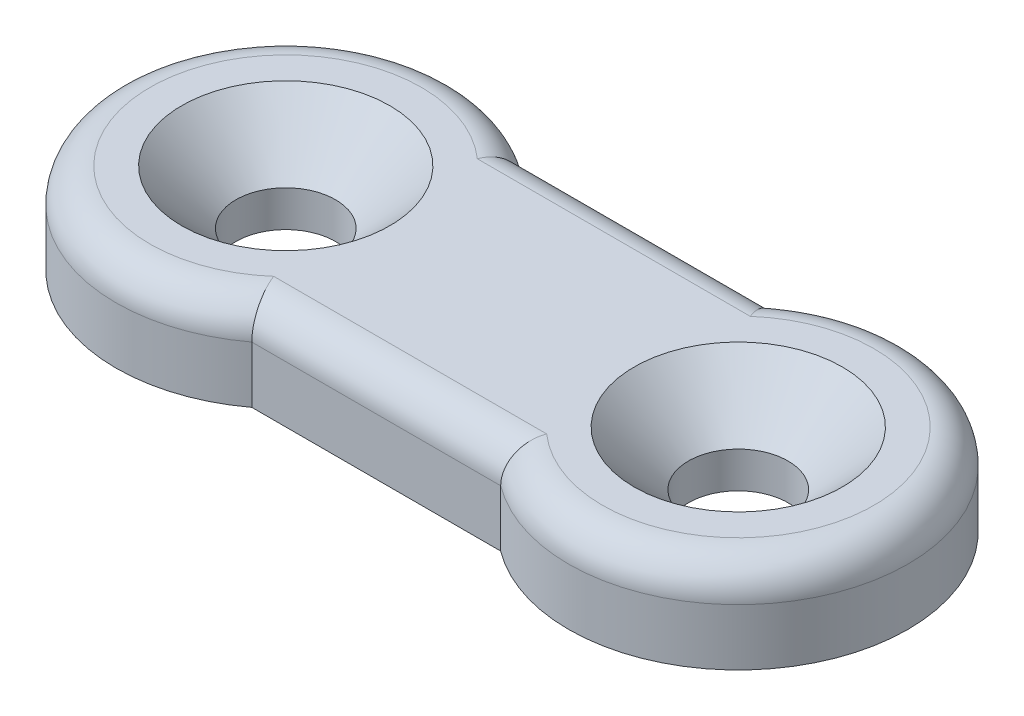
from build123d import *

# Parameters (mm, degrees)
SKETCH1_R           = 1.1
BOSS_EXTRUDE1_DEPTH = 2
BOSS_EXTRUDE3_START = -2
SKETCH3_R           = 3.75
SKETCH3_R_2         = 1.1
BOSS_EXTRUDE3_DEPTH = 2
CHAMFER1_SIZE       = 1.2
FILLET1_R           = 0.75


with BuildPart() as part:
    # Sketch1 → Boss-Extrude1 (new body)
    with BuildSketch(Plane(origin=(0, 0, 0), x_dir=(1, 0, 0), z_dir=(0, 1, 0))):
        with BuildLine():
            Line((-5, 3), (5, 3))
            ThreePointArc((5, 3), (8, 0), (5, -3))
            Line((5, -3), (-5, -3))
            ThreePointArc((-5, -3), (-8, 0), (-5, 3))
        make_face()
        with Locations(Location((-5, 0, 0), (0, 0, 270))):
            Circle(SKETCH1_R, mode=Mode.SUBTRACT)
        with Locations(Location((5, 0, 0), (0, 0, 270))):
            Circle(SKETCH1_R, mode=Mode.SUBTRACT)
    extrude(amount=BOSS_EXTRUDE1_DEPTH)

    # Sketch3 → Boss-Extrude3 (add)
    # profile 1 of 2: a face of its own
    with BuildSketch(Plane(origin=(0, 2, 0), x_dir=(1, 0, 0), z_dir=(0, 1, 0)).offset(BOSS_EXTRUDE3_START)):
        with Locations((-5, 0)):
            Circle(SKETCH3_R)
        with Locations(Location((-5, 0, 0), (0, 0, 270))):
            Circle(SKETCH3_R_2, mode=Mode.SUBTRACT)
    # profile 2 of 2: a face of its own
    with BuildSketch(Plane(origin=(0, 2, 0), x_dir=(1, 0, 0), z_dir=(0, 1, 0)).offset(BOSS_EXTRUDE3_START)):
        with Locations((5, 0)):
            Circle(SKETCH3_R)
        with Locations(Location((5, 0, 0), (0, 0, 270))):
            Circle(SKETCH3_R_2, mode=Mode.SUBTRACT)
    extrude(amount=BOSS_EXTRUDE3_DEPTH)

    # Chamfer1
    chamfer1_edges = [part.edges().sort_by_distance(p)[0] for p in [
        (-5, 2, -1.1),
        (5, 2, -1.1),
    ]]
    chamfer(chamfer1_edges, length=CHAMFER1_SIZE)

    # Fillet1
    fillet1_edges = [part.edges().sort_by_distance(p)[0] for p in [
        (0, 2, 3),
        (-8.75, 2, 0),
        (0, 2, -3),
        (8.75, 2, 0),
    ]]
    fillet(fillet1_edges, radius=FILLET1_R)


solid = part.part
